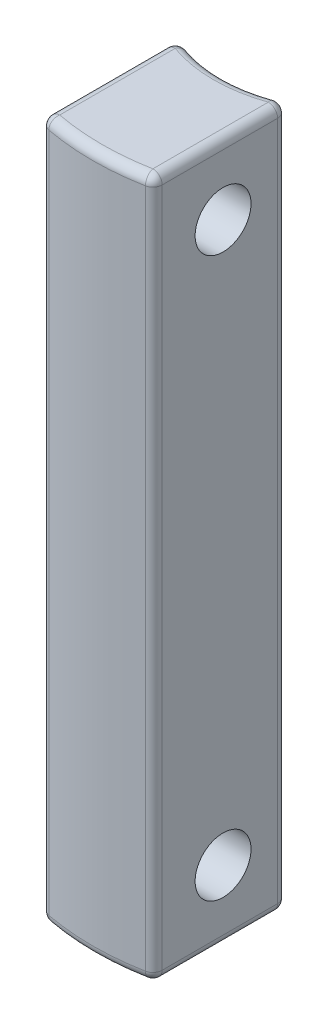
from build123d import *

# Parameters (mm, degrees)
EXTRUDE_1_DEPTH          = 37.5
CUT_EXTRUDE_1_DEPTH      = 39.810570802
CUT_EXTRUDE_1_DEPTH_BACK = 39.810570802
SKETCH_2_R               = 3
FILLET_2_R               = 1


with BuildPart() as part:
    # 草图1 → 凸台-拉伸1 (new, symmetric)
    with BuildSketch(Plane(origin=(0, 0, 0), x_dir=(1, 0, 0), z_dir=(0, 1, 0))):
        with BuildLine():
            Line((-6, -7.350239011), (-6, 7.350239011))
            ThreePointArc((-6, 7.350239011), (0, 5.999349652), (6, 7.350239011))
            Line((6, 7.350239011), (6, -7.350239011))
            ThreePointArc((6, -7.350239011), (0, -8.000650348), (-6, -7.350239011))
        make_face()
    extrude(amount=EXTRUDE_1_DEPTH, both=True)

    # 草图2 → 切除-拉伸1 (cut, two sides: drawn at the far end of the back side and taken through both)
    with BuildSketch(Plane(origin=(0, 0, 0), x_dir=(0, 0, -1), z_dir=(1, 0, 0)).offset(-CUT_EXTRUDE_1_DEPTH_BACK)):
        with Locations((0, 30)):
            Circle(SKETCH_2_R)
        with Locations((0, -30)):
            Circle(SKETCH_2_R)
    extrude(amount=CUT_EXTRUDE_1_DEPTH + CUT_EXTRUDE_1_DEPTH_BACK, mode=Mode.SUBTRACT)

    # 圆角2
    fillet_2_edges = [part.edges().sort_by_distance(p)[0] for p in [
        (0, 37.5, -5.999349652),
        (-6, 37.5, 0),
        (0, 37.5, 8.000650348),
        (-6, -37.5, 0),
        (0, -37.5, -5.999349652),
        (6, -37.5, 0),
        (0, -37.5, 8.000650348),
        (-6, 0, 7.350239011),
        (-6, 0, -7.350239011),
        (6, 0, -7.350239011),
        (6, 0, 7.350239011),
        (6, 37.5, 0),
    ]]
    fillet(fillet_2_edges, radius=FILLET_2_R)


solid = part.part
